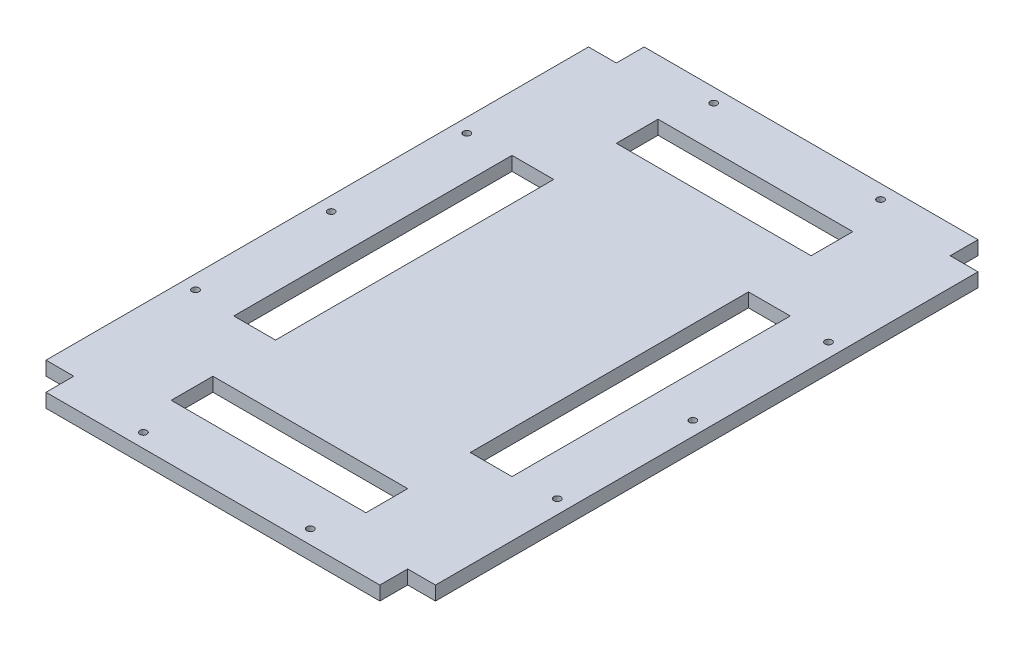
from build123d import *

# Parameters (mm, degrees)
BOSS_EXTRUDE1_DEPTH = 5
SKETCH2_R           = 2.5
SKETCH2_W           = 30
SKETCH2_H           = 200
SKETCH2_W_2         = 140
SKETCH2_H_2         = 30
CUT_EXTRUDE1_DEPTH  = 10


with BuildPart() as part:
    # Sketch1 → Boss-Extrude1 (new, symmetric)
    with BuildSketch(Plane(origin=(0, 0, 0), x_dir=(1, 0, 0), z_dir=(0, 1, 0))):
        Polygon((120, 215), (-120, 215), (-120, 195), (-140, 195), (-140, -195), (-120, -195), (-120, -215), (120, -215), (120, -195), (140, -195), (140, 195), (120, 195), align=None)
    extrude(amount=BOSS_EXTRUDE1_DEPTH, both=True)

    # Sketch2 → Cut-Extrude1 (cut)
    with BuildSketch(Plane(origin=(0, 5, 0), x_dir=(1, 0, 0), z_dir=(0, 1, 0))):
        with Locations(Location((-60, 205, 0), (0, 0, 270))):
            Circle(SKETCH2_R)
        with Locations(Location((60, 205, 0), (0, 0, 270))):
            Circle(SKETCH2_R)
        with Locations(Location((130, 97.5, 0), (0, 0, 270))):
            Circle(SKETCH2_R)
        with Locations(Location((130, -97.5, 0), (0, 0, 270))):
            Circle(SKETCH2_R)
        with Locations(Location((130, 0, 0), (0, 0, 270))):
            Circle(SKETCH2_R)
        with Locations(Location((60, -205, 0), (0, 0, 270))):
            Circle(SKETCH2_R)
        with Locations(Location((-60, -205, 0), (0, 0, 270))):
            Circle(SKETCH2_R)
        with Locations(Location((-130, 97.5, 0), (0, 0, 270))):
            Circle(SKETCH2_R)
        with Locations(Location((-130, 0, 0), (0, 0, 270))):
            Circle(SKETCH2_R)
        with Locations(Location((-130, -97.5, 0), (0, 0, 270))):
            Circle(SKETCH2_R)
        with Locations((85, 0)):
            Rectangle(SKETCH2_W, SKETCH2_H)
        with Locations((-85, 0)):
            Rectangle(SKETCH2_W, SKETCH2_H)
        with Locations((0, 160)):
            Rectangle(SKETCH2_W_2, SKETCH2_H_2)
        with Locations((0, -160)):
            Rectangle(SKETCH2_W_2, SKETCH2_H_2)
    extrude(amount=-CUT_EXTRUDE1_DEPTH, mode=Mode.SUBTRACT)


solid = part.part
